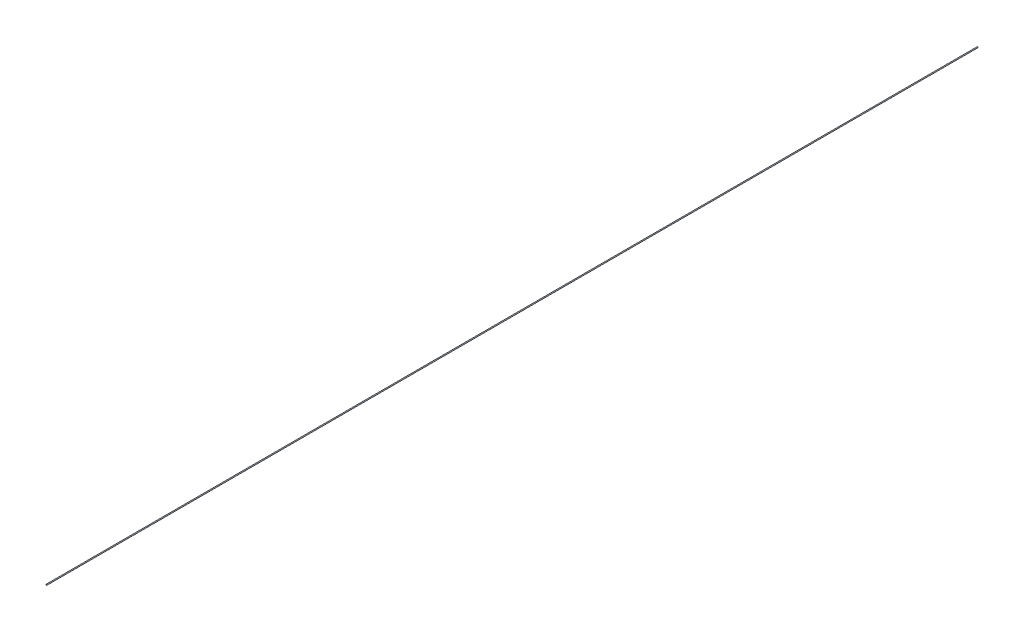
from build123d import *

# Parameters (mm, degrees)
SKETCH3_R           = 0.5
BOSS_EXTRUDE1_DEPTH = 508
FILLET1_R           = 0.4


with BuildPart() as part:
    # Sketch3 → Boss-Extrude1 (new, symmetric)
    with BuildSketch(Plane.XY):
        Circle(SKETCH3_R)
    extrude(amount=BOSS_EXTRUDE1_DEPTH, both=True)

    # Fillet1
    fillet1_edges = [part.edges().sort_by_distance(p)[0] for p in [
        (-0.5, 0, -508),
        (-0.5, 0, 508),
    ]]
    fillet(fillet1_edges, radius=FILLET1_R)


solid = part.part
